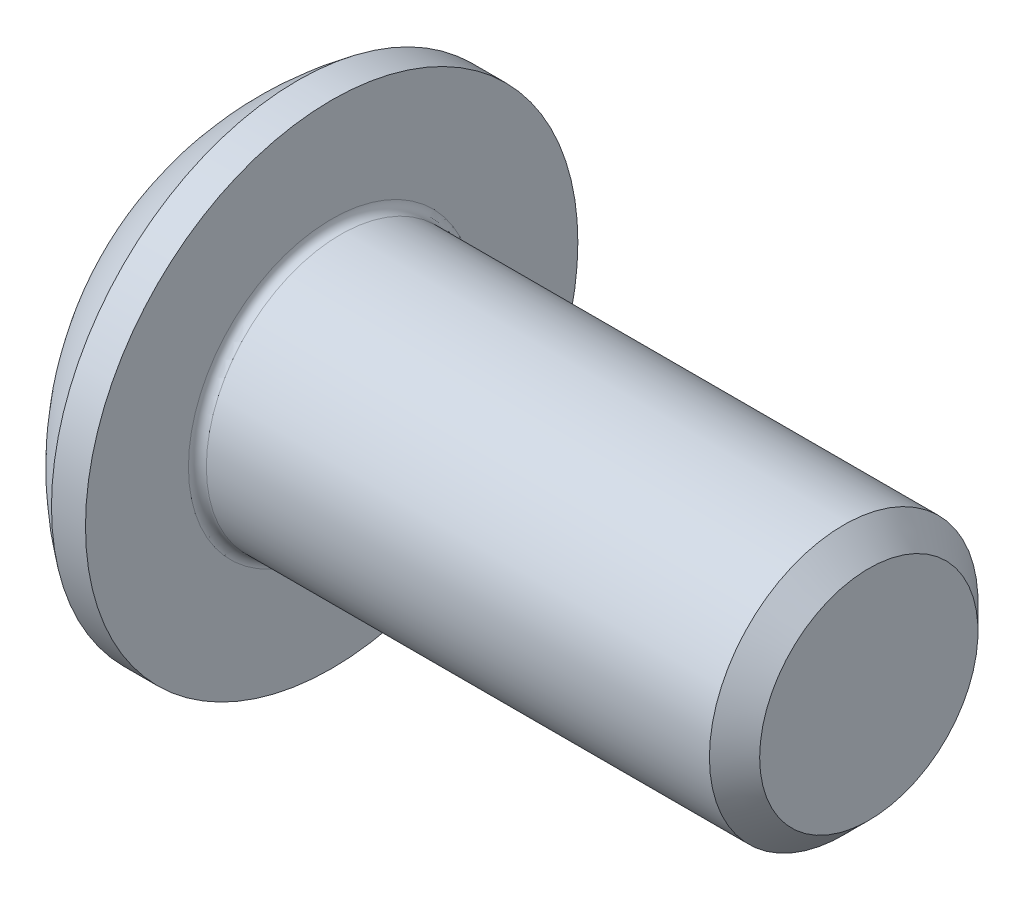
from build123d import *

# Parameters (mm, degrees)
FILLET1_R   = 0.1
HEX_2_DEPTH = 1.04


with BuildPart() as part:
    # BodySke → BaseBody (revolve)
    with BuildSketch(Plane.XY, mode=Mode.PRIVATE) as basebody_sk:
        with BuildLine():
            Line((7.5, 0), (7.5, 1.2195))
            Line((7.5, 1.2195), (7.2195, 1.5))
            Line((7.2195, 1.5), (1.5, 1.5))
            Line((1.5, 1.5), (1.5, 2.75))
            Line((1.5, 2.75), (1.12, 2.75))
            ThreePointArc((1.12, 2.75), (0.468326185, 2.13717249), (0, 1.375))
            Line((0, 1.375), (0, 0))
            Line((0, 0), (7.5, 0))
        make_face()
    revolve(basebody_sk.sketch.rotate(Axis((0, 0, 0), (1, 0, 0)), 90), axis=Axis((0, 0, 0), (1, 0, 0)))

    # Fillet1
    fillet1_edges = [part.edges().sort_by_distance(p)[0] for p in [
        (1.5, 0, -1.5),
    ]]
    fillet(fillet1_edges, radius=FILLET1_R)

    # Sketch2 → PreBroach (revolve, cut)
    with BuildSketch(Plane.XY, mode=Mode.PRIVATE) as prebroach_sk:
        Polygon((0, 1), (1.04, 1), (1.617350269, 0), (0, 0), align=None)
    revolve(prebroach_sk.sketch.rotate(Axis((0, 0, 0), (1, 0, 0)), 90), axis=Axis((0, 0, 0), (1, 0, 0)), mode=Mode.SUBTRACT)

    # Sketch3 → Hex 2 (cut)
    with BuildSketch(Plane(origin=(0, 0, 0), x_dir=(0, 0, -1), z_dir=(1, 0, 0))):
        Polygon((-1, -0.577350269), (-1, 0.577350269), (0, 1.154700538), (1, 0.577350269), (1, -0.577350269), (0, -1.154700538), align=None)
    extrude(amount=HEX_2_DEPTH, mode=Mode.SUBTRACT)


solid = part.part
